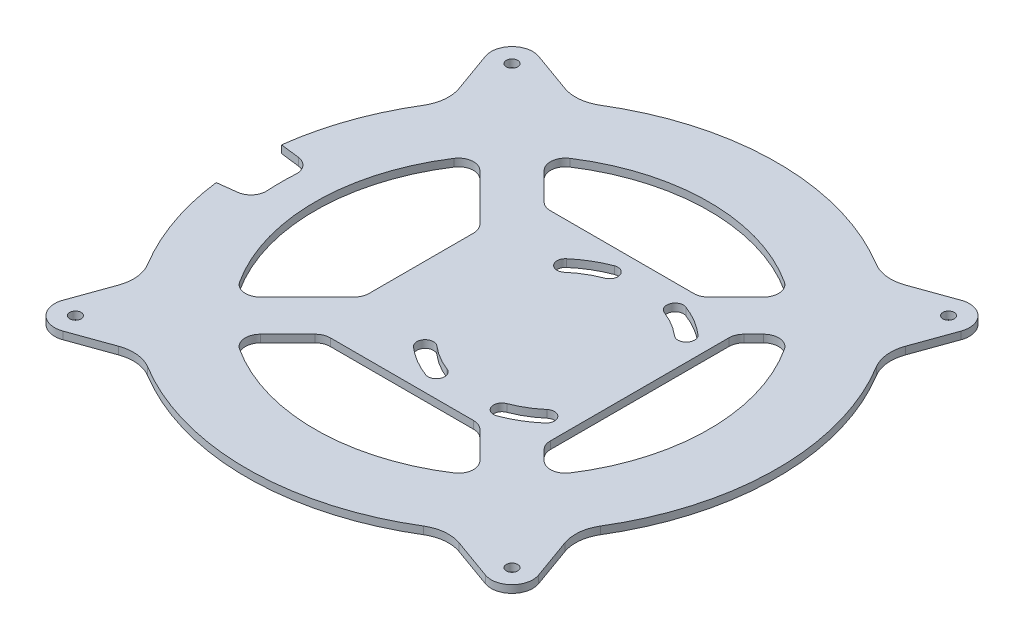
from build123d import *

# Parameters (mm, degrees)
SKETCH_1_R      = 0.75
EXTRUDE_1_DEPTH = 1


with BuildPart() as part:
    # 草图1 → 凸台-拉伸1 (new body)
    with BuildSketch(Plane(origin=(0, 0, 0), x_dir=(1, 0, 0), z_dir=(0, 1, 0))):
        with BuildLine():
            Line((29.46455474, 22.480687159), (31.403167944, 27.886257161))
            ThreePointArc((31.403167944, 27.886257161), (30.759144982, 30.759144982), (27.886257161, 31.403167944))
            Line((27.886257161, 31.403167944), (22.480687159, 29.46455474))
            ThreePointArc((22.480687159, 29.46455474), (20.287911996, 29.196594839), (18.19369008, 29.899659551))
            ThreePointArc((18.19369008, 29.899659551), (9.447537132, 33.700801803), (0, 35))
            ThreePointArc((0, 35), (-9.447537132, 33.700801803), (-18.19369008, 29.899659551))
            ThreePointArc((-18.19369008, 29.899659551), (-20.287911996, 29.196594839), (-22.480687159, 29.46455474))
            Line((-22.480687159, 29.46455474), (-27.886257161, 31.403167944))
            ThreePointArc((-27.886257161, 31.403167944), (-30.759144982, 30.759144982), (-31.403167944, 27.886257161))
            Line((-31.403167944, 27.886257161), (-29.46455474, 22.480687159))
            ThreePointArc((-29.46455474, 22.480687159), (-29.196594839, 20.287911996), (-29.899659551, 18.19369008))
            ThreePointArc((-29.899659551, 18.19369008), (-33.052834782, 11.511303701), (-34.732884242, 4.315872125))
            Line((-34.732884242, 4.315872125), (-32.190837206, 4))
            ThreePointArc((-32.190837206, 4), (-30.89823255, 3.292285123), (-30.441307179, 1.891247526))
            ThreePointArc((-30.441307179, 1.891247526), (-30.5, 0), (-30.441307179, -1.891247526))
            ThreePointArc((-30.441307179, -1.891247526), (-30.89823255, -3.292285123), (-32.190837206, -4))
            Line((-32.190837206, -4), (-34.732884242, -4.315872125))
            ThreePointArc((-34.732884242, -4.315872125), (-33.052834782, -11.511303701), (-29.899659551, -18.19369008))
            ThreePointArc((-29.899659551, -18.19369008), (-29.196594839, -20.287911996), (-29.46455474, -22.480687159))
            Line((-29.46455474, -22.480687159), (-31.403167944, -27.886257161))
            ThreePointArc((-31.403167944, -27.886257161), (-30.759144982, -30.759144982), (-27.886257161, -31.403167944))
            Line((-27.886257161, -31.403167944), (-22.480687159, -29.46455474))
            ThreePointArc((-22.480687159, -29.46455474), (-20.287911996, -29.196594839), (-18.19369008, -29.899659551))
            ThreePointArc((-18.19369008, -29.899659551), (-9.447537132, -33.700801803), (0, -35))
            ThreePointArc((0, -35), (9.447537132, -33.700801803), (18.19369008, -29.899659551))
            ThreePointArc((18.19369008, -29.899659551), (20.287911996, -29.196594839), (22.480687159, -29.46455474))
            Line((22.480687159, -29.46455474), (27.886257161, -31.403167944))
            ThreePointArc((27.886257161, -31.403167944), (30.759144982, -30.759144982), (31.403167944, -27.886257161))
            Line((31.403167944, -27.886257161), (29.46455474, -22.480687159))
            ThreePointArc((29.46455474, -22.480687159), (29.196594839, -20.287911996), (29.899659551, -18.19369008))
            ThreePointArc((29.899659551, -18.19369008), (33.700801803, -9.447537132), (35, 0))
            ThreePointArc((35, 0), (33.700801803, 9.447537132), (29.899659551, 18.19369008))
            ThreePointArc((29.899659551, 18.19369008), (29.196594839, 20.287911996), (29.46455474, 22.480687159))
        make_face()
        with Locations(Location((-28.814601333, -28.814601333, 0), (0, 0, 270))):
            Circle(SKETCH_1_R, mode=Mode.SUBTRACT)
        with BuildLine():
            Line((-14.476872329, -18.719513016), (-10.868928268, -15.111568955))
            ThreePointArc((-10.868928268, -15.111568955), (-10.22008157, -14.678023452), (-9.454714705, -14.525782517))
            Line((-9.454714705, -14.525782517), (9.454714705, -14.525782517))
            ThreePointArc((9.454714705, -14.525782517), (10.22008157, -14.678023452), (10.868928268, -15.111568955))
            Line((10.868928268, -15.111568955), (14.476872329, -18.719513016))
            ThreePointArc((14.476872329, -18.719513016), (15.051657451, -20.343212221), (14.151213664, -21.811537127))
            ThreePointArc((14.151213664, -21.811537127), (0, -26), (-14.151213664, -21.811537127))
            ThreePointArc((-14.151213664, -21.811537127), (-15.051657451, -20.343212221), (-14.476872329, -18.719513016))
        make_face(mode=Mode.SUBTRACT)
        with BuildLine():
            ThreePointArc((1.828205899, -10.397220329), (2.466819597, -11.815731007), (1.048308919, -12.454344705))
            ThreePointArc((1.048308919, -12.454344705), (-1.042632246, -11.445222173), (-2.926575027, -10.088342356))
            ThreePointArc((-2.926575027, -10.088342356), (-3.041516382, -8.536959591), (-1.490133616, -8.422018236))
            ThreePointArc((-1.490133616, -8.422018236), (0.082632246, -9.554777827), (1.828205899, -10.397220329))
        make_face(mode=Mode.SUBTRACT)
        with Locations(Location((28.814601333, -28.814601333, 0), (0, 0, 270))):
            Circle(SKETCH_1_R, mode=Mode.SUBTRACT)
        with BuildLine():
            ThreePointArc((14.466575027, -10.088342356), (12.582632246, -11.445222173), (10.491691081, -12.454344705))
            ThreePointArc((10.491691081, -12.454344705), (9.073180403, -11.815731007), (9.711794101, -10.397220329))
            ThreePointArc((9.711794101, -10.397220329), (11.457367754, -9.554777827), (13.030133616, -8.422018236))
            ThreePointArc((13.030133616, -8.422018236), (14.581516382, -8.536959591), (14.466575027, -10.088342356))
        make_face(mode=Mode.SUBTRACT)
        with BuildLine():
            Line((-11.97, 6.898932188), (-11.97, -6.898932188))
            ThreePointArc((-11.97, -6.898932188), (-12.122240935, -7.664299053), (-12.555786438, -8.313145751))
            Line((-12.555786438, -8.313145751), (-18.719513016, -14.476872329))
            ThreePointArc((-18.719513016, -14.476872329), (-20.343212221, -15.051657451), (-21.811537127, -14.151213664))
            ThreePointArc((-21.811537127, -14.151213664), (-26, 0), (-21.811537127, 14.151213664))
            ThreePointArc((-21.811537127, 14.151213664), (-20.343212221, 15.051657451), (-18.719513016, 14.476872329))
            Line((-18.719513016, 14.476872329), (-12.555786438, 8.313145751))
            ThreePointArc((-12.555786438, 8.313145751), (-12.122240935, 7.664299053), (-11.97, 6.898932188))
        make_face(mode=Mode.SUBTRACT)
        with BuildLine():
            ThreePointArc((-2.926575027, 10.088342356), (-1.042632246, 11.445222173), (1.048308919, 12.454344705))
            ThreePointArc((1.048308919, 12.454344705), (2.466819597, 11.815731007), (1.828205899, 10.397220329))
            ThreePointArc((1.828205899, 10.397220329), (0.082632246, 9.554777827), (-1.490133616, 8.422018236))
            ThreePointArc((-1.490133616, 8.422018236), (-3.041516382, 8.536959591), (-2.926575027, 10.088342356))
        make_face(mode=Mode.SUBTRACT)
        with Locations(Location((-28.814601333, 28.814601333, 0), (0, 0, 270))):
            Circle(SKETCH_1_R, mode=Mode.SUBTRACT)
        with BuildLine():
            ThreePointArc((10.868928268, 15.111568955), (10.22008157, 14.678023452), (9.454714705, 14.525782517))
            Line((9.454714705, 14.525782517), (-9.454714705, 14.525782517))
            ThreePointArc((-9.454714705, 14.525782517), (-10.22008157, 14.678023452), (-10.868928268, 15.111568955))
            Line((-10.868928268, 15.111568955), (-14.476872329, 18.719513016))
            ThreePointArc((-14.476872329, 18.719513016), (-15.051657451, 20.343212221), (-14.151213664, 21.811537127))
            ThreePointArc((-14.151213664, 21.811537127), (0, 26), (14.151213664, 21.811537127))
            ThreePointArc((14.151213664, 21.811537127), (15.051657451, 20.343212221), (14.476872329, 18.719513016))
            Line((14.476872329, 18.719513016), (10.868928268, 15.111568955))
        make_face(mode=Mode.SUBTRACT)
        with BuildLine():
            ThreePointArc((9.711794101, 10.397220329), (9.073180403, 11.815731007), (10.491691081, 12.454344705))
            ThreePointArc((10.491691081, 12.454344705), (12.582632246, 11.445222173), (14.466575027, 10.088342356))
            ThreePointArc((14.466575027, 10.088342356), (14.581516382, 8.536959591), (13.030133616, 8.422018236))
            ThreePointArc((13.030133616, 8.422018236), (11.457367754, 9.554777827), (9.711794101, 10.397220329))
        make_face(mode=Mode.SUBTRACT)
        with BuildLine():
            ThreePointArc((21.811537127, -14.151213664), (20.343212221, -15.051657451), (18.719513016, -14.476872329))
            Line((18.719513016, -14.476872329), (17.434140759, -13.191500072))
            ThreePointArc((17.434140759, -13.191500072), (17.000595257, -12.542653375), (16.848354322, -11.77728651))
            Line((16.848354322, -11.77728651), (16.848354322, 11.77728651))
            ThreePointArc((16.848354322, 11.77728651), (17.000595257, 12.542653375), (17.434140759, 13.191500072))
            Line((17.434140759, 13.191500072), (18.719513016, 14.476872329))
            ThreePointArc((18.719513016, 14.476872329), (20.343212221, 15.051657451), (21.811537127, 14.151213664))
            ThreePointArc((21.811537127, 14.151213664), (26, 0), (21.811537127, -14.151213664))
        make_face(mode=Mode.SUBTRACT)
        with Locations(Location((28.814601333, 28.814601333, 0), (0, 0, 270))):
            Circle(SKETCH_1_R, mode=Mode.SUBTRACT)
    extrude(amount=EXTRUDE_1_DEPTH)


solid = part.part
